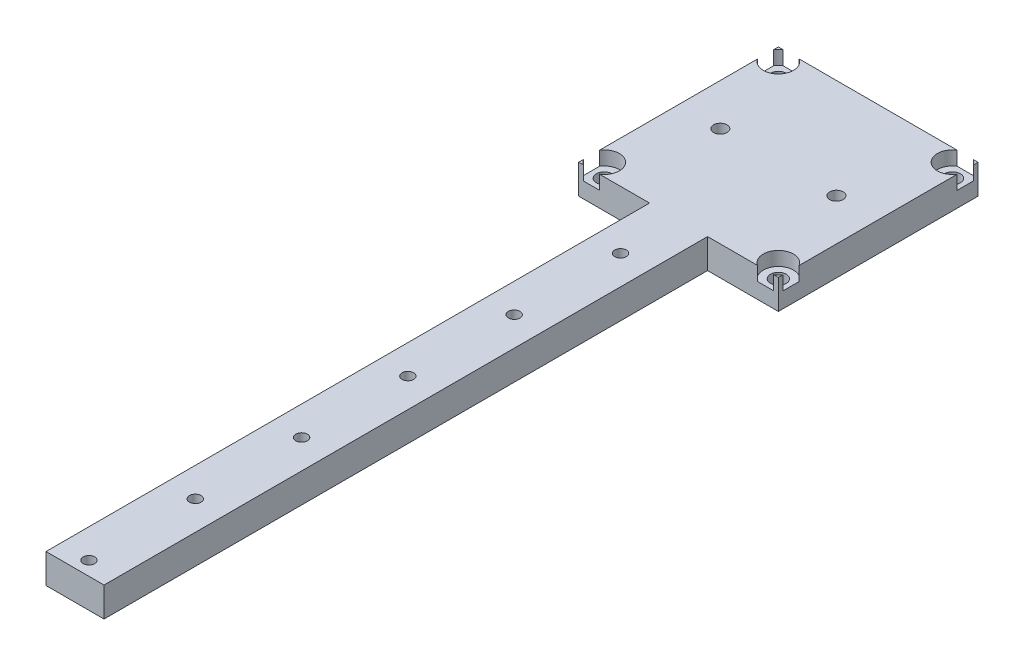
from build123d import *

# Parameters (mm, degrees)
EXTRUDE1_DEPTH                 = 6.35
LPATTERN1_COUNT                = 6
LPATTERN1_PITCH                = 22.9
CBORE_FOR_M3_SHCS1_D           = 3.4
CBORE_FOR_M3_SHCS1_CBORE_D     = 6.5
CBORE_FOR_M3_SHCS1_CBORE_DEPTH = 3
LPATTERN2_COUNT                = 2
LPATTERN2_PITCH                = 37.5
LPATTERN2_COUNT_DIR2           = 2
LPATTERN2_PITCH_DIR2           = 37.5
F_2_9_2_9_DIAMETER_HOLE1_D     = 2.9


with BuildPart() as part:
    # Sketch2 → Extrude1 (new body)
    with BuildSketch(Plane(origin=(0, 0, 0), x_dir=(1, 0, 0), z_dir=(0, 1, 0))):
        Polygon((-6.25, -21.5), (-21.5, -21.5), (-21.5, 21.5), (21.5, 21.5), (21.5, -21.5), (6.25, -21.5), (6.25, -151.5), (-6.25, -151.5), align=None)
    extrude(amount=EXTRUDE1_DEPTH)

    # Sketch5 → M3x0.5 Tapped Hole1 (revolve, cut)
    with BuildSketch(Plane(origin=(0, 6.35, 148.5), x_dir=(0, 0, 1), z_dir=(1, 0, 0))):
        Polygon((0, 0), (0, 8.251075774), (1.25, 7.5), (1.25, 0), align=None)
    m3x0_5_tapped_hole1 = revolve(axis=Axis((0, 12.7, 148.5), (0, -1, 0)), mode=Mode.SUBTRACT)

    # LPattern1: M3x0.5 Tapped Hole1 ×6
    with Locations(*[(0, 0, -i * LPATTERN1_PITCH) for i in range(1, LPATTERN1_COUNT)]):
        add(m3x0_5_tapped_hole1, mode=Mode.SUBTRACT)

    # CBORE for M3 SHCS1 (through all)
    with Locations(Plane(origin=(-18.75, 6.35, -18.75), x_dir=(0, 0, 1), z_dir=(0, 1, 0))):
        with Locations((0, 0)):
            cbore_for_m3_shcs1 = CounterBoreHole(CBORE_FOR_M3_SHCS1_D / 2, CBORE_FOR_M3_SHCS1_CBORE_D / 2, CBORE_FOR_M3_SHCS1_CBORE_DEPTH)

    # LPattern2: CBORE for M3 SHCS1 2 × 2
    with Locations(*[(i * LPATTERN2_PITCH, 0, j * LPATTERN2_PITCH_DIR2) for i in range(LPATTERN2_COUNT) for j in range(LPATTERN2_COUNT_DIR2) if (i, j) != (0, 0)]):
        add(cbore_for_m3_shcs1, mode=Mode.SUBTRACT)

    # Ø2.9 (2.9) Diameter Hole1 (through all)
    with Locations(Plane(origin=(-12.5, 6.35, 0), x_dir=(0, 0, 1), z_dir=(0, 1, 0))):
        with Locations((0, 0), (0, 25)):
            Hole(F_2_9_2_9_DIAMETER_HOLE1_D / 2)


solid = part.part
